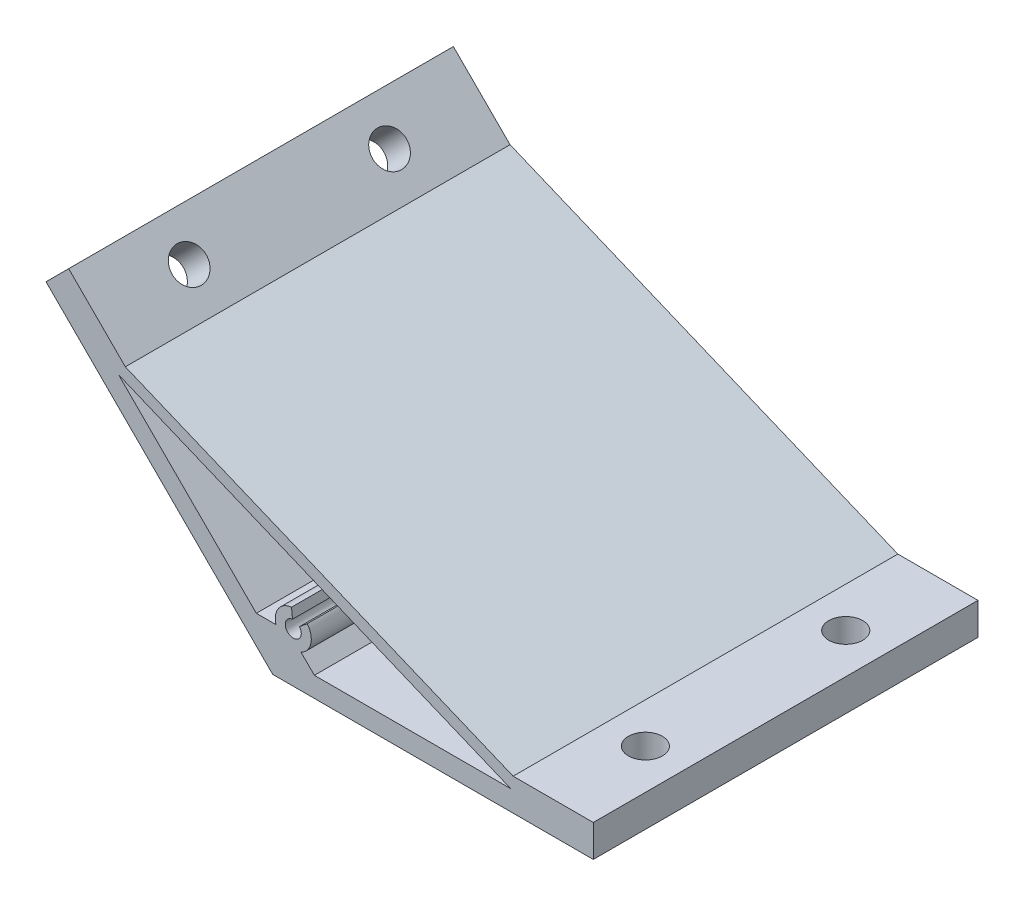
from build123d import *

# Parameters (mm, degrees)
EXTRUDE_1_DEPTH         = 48
HOLE_WIZARD_8_5_8_5_1_D = 8.5


with BuildPart() as part:
    # 草图1 → 凸台-拉伸1 (new, symmetric)
    with BuildSketch(Plane.XY):
        Polygon((6936.119122288, -1232.086390659), (6992.687664783, -1288.654933154), (7072.687664783, -1288.654933154), (7072.687664783, -1280.654933154), (7052.687664783, -1280.654933154), (6955.918112162, -1240.571672033), (6941.775976538, -1226.429536409), align=None)
        with BuildLine():
            Line((7009.090927681, -1283.654933154), (7003.090927681, -1283.654933154))
            Line((7003.090927681, -1283.654933154), (6999.760549745, -1280.324555218))
            ThreePointArc((6999.760549745, -1280.324555218), (7002.213755914, -1277.239517812), (7001.296666197, -1273.406161221))
            Line((7001.296666197, -1273.406161221), (6999.365595427, -1274.993916141))
            ThreePointArc((6999.365595427, -1274.993916141), (6997.055371947, -1278.111879141), (6997.626530039, -1274.273571671))
            Line((6997.626530039, -1274.273571671), (6997.383769074, -1271.785386165))
            ThreePointArc((6997.383769074, -1271.785386165), (6994.101203016, -1273.731324494), (6993.49338103, -1277.49861375))
            Line((6993.49338103, -1277.49861375), (6988.602413191, -1277.49861375))
            Line((6988.602413191, -1277.49861375), (6954.21874867, -1243.114949228))
            Line((6954.21874867, -1243.114949228), (7052.090927681, -1283.654933154))
            Line((7052.090927681, -1283.654933154), (7029.403393536, -1283.654933154))
            Line((7029.403393536, -1283.654933154), (7009.090927681, -1283.654933154))
        make_face(mode=Mode.SUBTRACT)
    extrude(amount=EXTRUDE_1_DEPTH, both=True)

    # Ø8.5 (8.5) 直径孔1 (through all)
    with Locations(Plane(origin=(2852.016365815, 2852.016365815, 0), x_dir=(0.7071067811865628, -0.7071067811865324, 0), z_dir=(-0.7071067811865324, -0.7071067811865628, 0))):
        with Locations((5785.79350833, -25), (5785.79350833, 25)):
            hole_wizard_8_5_8_5_1 = Hole(HOLE_WIZARD_8_5_8_5_1_D / 2)

    # 镜向1: Ø8.5 (8.5) 直径孔1 across plane
    add(hole_wizard_8_5_8_5_1.mirror(Plane(origin=(6424.240586557, -2661.0075789, 0), x_dir=(0, 0, 1), z_dir=(-0.9238795325112645, 0.3826834323651437, 0))), mode=Mode.SUBTRACT)


solid = part.part
